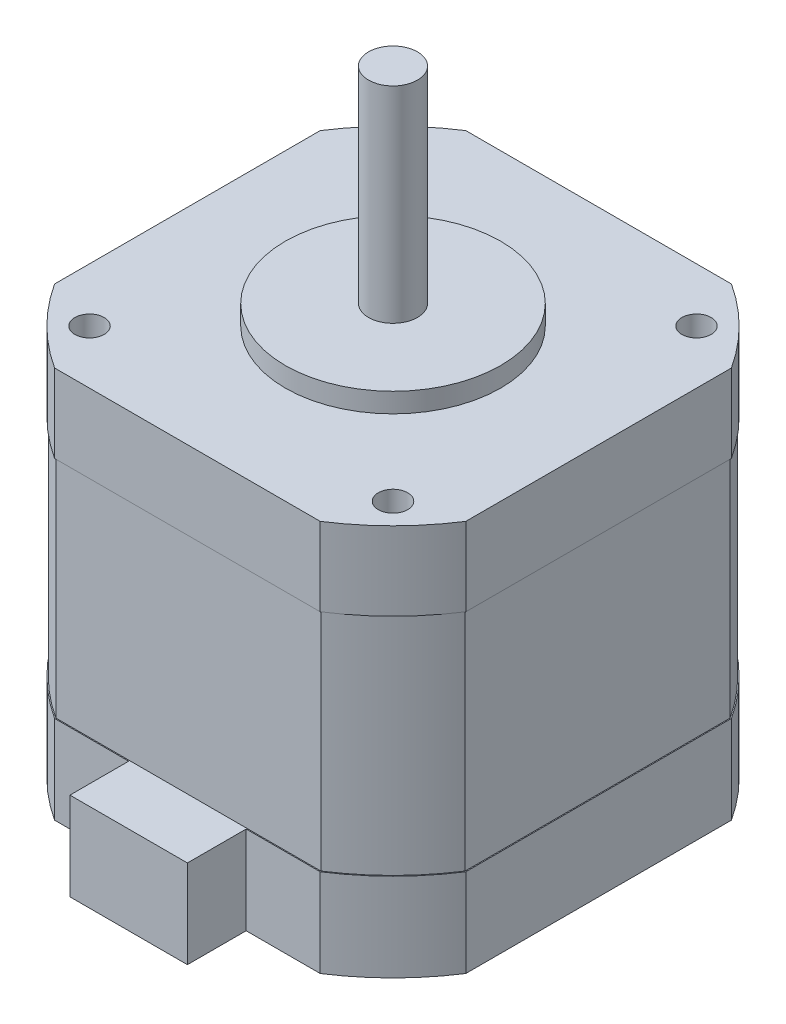
from build123d import *

# Parameters (mm, degrees)
EXTRUDE_1_DEPTH     = 9
SKETCH_2_W          = 12
SKETCH_2_H          = 9
EXTRUDE_2_DEPTH     = 6
EXTRUDE_3_DEPTH     = 23
EXTRUDE_4_DEPTH     = 8
SKETCH_6_R          = 1.5
CUT_EXTRUDE_1_DEPTH = 8
SKETCH_6_3_R        = 11
EXTRUDE_5_DEPTH     = 2
SKETCH_7_R          = 2.5
EXTRUDE_6_DEPTH     = 21


with BuildPart() as part:
    # Эскиз1 → Бобышка-Вытянуть1 (new body)
    with BuildSketch(Plane(origin=(0, 0, 0), x_dir=(1, 0, 0), z_dir=(0, 1, 0))):
        with BuildLine():
            ThreePointArc((-13.564659966, 21), (-17.67766953, 17.67766953), (-21, 13.564659966))
            Line((-21, 13.564659966), (-21, -13.564659966))
            ThreePointArc((-21, -13.564659966), (-17.67766953, -17.67766953), (-13.564659966, -21))
            Line((-13.564659966, -21), (13.564659966, -21))
            ThreePointArc((13.564659966, -21), (17.67766953, -17.67766953), (21, -13.564659966))
            Line((21, -13.564659966), (21, 13.564659966))
            ThreePointArc((21, 13.564659966), (17.67766953, 17.67766953), (13.564659966, 21))
            Line((13.564659966, 21), (-13.564659966, 21))
        make_face()
    extrude(amount=EXTRUDE_1_DEPTH)

    # Эскиз2 → Бобышка-Вытянуть2 (add)
    with BuildSketch(Plane.XY.offset(21)):
        with Locations((0, 4.5)):
            Rectangle(SKETCH_2_W, SKETCH_2_H)
    extrude(amount=EXTRUDE_2_DEPTH)

    # Эскиз4 → Бобышка-Вытянуть3 (add)
    with BuildSketch(Plane(origin=(0, 9, 0), x_dir=(1, 0, 0), z_dir=(0, 1, 0))):
        with BuildLine():
            Line((-20.9, 13.535139453), (-20.9, -13.535139453))
            ThreePointArc((-20.9, -13.535139453), (-17.606958852, -17.606958852), (-13.535139453, -20.9))
            Line((-13.535139453, -20.9), (13.535139453, -20.9))
            ThreePointArc((13.535139453, -20.9), (17.606958852, -17.606958852), (20.9, -13.535139453))
            Line((20.9, -13.535139453), (20.9, 13.535139453))
            ThreePointArc((20.9, 13.535139453), (17.606958852, 17.606958852), (13.535139453, 20.9))
            Line((13.535139453, 20.9), (-13.535139453, 20.9))
            ThreePointArc((-13.535139453, 20.9), (-17.606958852, 17.606958852), (-20.9, 13.535139453))
        make_face()
    extrude(amount=EXTRUDE_3_DEPTH)

    # Эскиз5 → Бобышка-Вытянуть4 (add)
    with BuildSketch(Plane(origin=(0, 32, 0), x_dir=(1, 0, 0), z_dir=(0, 1, 0))):
        with BuildLine():
            Line((21, -13.564659966), (21, 13.564659966))
            ThreePointArc((21, 13.564659966), (17.67766953, 17.67766953), (13.564659966, 21))
            Line((13.564659966, 21), (-13.564659966, 21))
            ThreePointArc((-13.564659966, 21), (-17.67766953, 17.67766953), (-21, 13.564659966))
            Line((-21, 13.564659966), (-21, -13.564659966))
            ThreePointArc((-21, -13.564659966), (-17.67766953, -17.67766953), (-13.564659966, -21))
            Line((-13.564659966, -21), (13.564659966, -21))
            ThreePointArc((13.564659966, -21), (17.67766953, -17.67766953), (21, -13.564659966))
        make_face()
    extrude(amount=EXTRUDE_4_DEPTH)

    # Эскиз6 → Вырез-Вытянуть1 (cut)
    with BuildSketch(Plane(origin=(0, 40, 0), x_dir=(1, 0, 0), z_dir=(0, 1, 0))):
        with Locations((-15.5, -15.5)):
            Circle(SKETCH_6_R)
        with Locations((-15.5, 15.5)):
            Circle(SKETCH_6_R)
        with Locations((15.5, 15.5)):
            Circle(SKETCH_6_R)
        with Locations((15.5, -15.5)):
            Circle(SKETCH_6_R)
    extrude(amount=-CUT_EXTRUDE_1_DEPTH, mode=Mode.SUBTRACT)

    # Эскиз6<3> → Бобышка-Вытянуть5 (add)
    with BuildSketch(Plane(origin=(0, 40, 0), x_dir=(1, 0, 0), z_dir=(0, 1, 0))):
        Circle(SKETCH_6_3_R)
    extrude(amount=EXTRUDE_5_DEPTH)

    # Эскиз7 → Бобышка-Вытянуть6 (add)
    with BuildSketch(Plane(origin=(0, 42, 0), x_dir=(1, 0, 0), z_dir=(0, 1, 0))):
        Circle(SKETCH_7_R)
    extrude(amount=EXTRUDE_6_DEPTH)


solid = part.part
